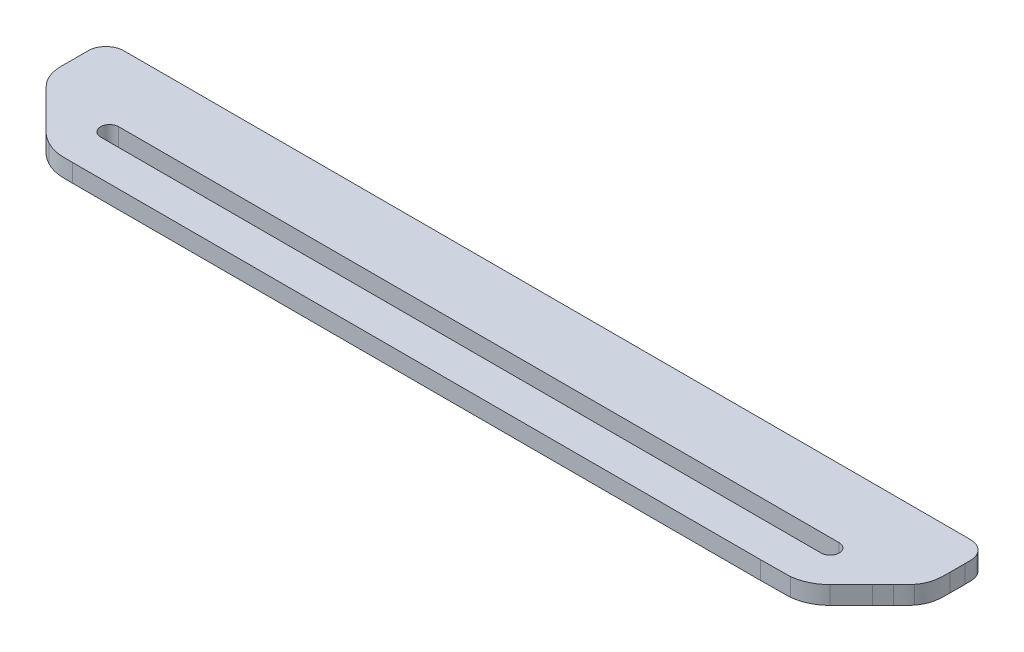
from build123d import *

# Parameters (mm, degrees)
BOSS_EXTRUDE3_DEPTH = 6.35
CUT_EXTRUDE2_DEPTH  = 315.468278946


with BuildPart() as part:
    # Sketch7 → Boss-Extrude3 (new body)
    with BuildSketch(Plane(origin=(0, 0, 0), x_dir=(1, 0, 0), z_dir=(0, 1, 0))):
        with BuildLine():
            add(Edge.make_bspline(
                [(185.1020682, 43.3705), (128.8643346, 43.3705), (72.6196922, 43.3705), (16.3750752, 43.3705)],
                knots=[0, 0, 0, 0, 1, 1, 1, 1], degree=3))
            add(Edge.make_bspline(
                [(16.3750752, 43.3705), (14.6249644, 43.3705), (12.881737, 43.3705), (11.1316262, 43.3705)],
                knots=[0, 0, 0, 0, 1, 1, 1, 1], degree=3))
            add(Edge.make_bspline(
                [(11.1316262, 43.3705), (10.6424476, 43.3705), (6.4187324, 43.3909978), (5.9295284, 43.3360068)],
                knots=[0, 0, 0, 0, 1, 1, 1, 1], degree=3))
            add(Edge.make_bspline(
                [(5.9295284, 43.3360068), (4.0760904, 43.1430938), (2.4017732, 42.1439848), (1.3475716, 40.607488)],
                knots=[0, 0, 0, 0, 1, 1, 1, 1], degree=3))
            add(Edge.make_bspline(
                [(1.3475716, 40.607488), (0.1348994, 38.8367016), (0.238252, 37.5137934), (0.238252, 35.550094)],
                knots=[0, 0, 0, 0, 1, 1, 1, 1], degree=3))
            add(Edge.make_bspline(
                [(0.238252, 35.550094), (0.238252, 33.7999578), (0.238252, 32.049847), (0.238252, 30.2997616)],
                knots=[0, 0, 0, 0, 1, 1, 1, 1], degree=3))
            add(Edge.make_bspline(
                [(0.238252, 30.2997616), (0.238252, 28.5565342), (0.1279906, 26.827099), (0.4656328, 25.0769882)],
                knots=[0, 0, 0, 0, 1, 1, 1, 1], degree=3))
            add(Edge.make_bspline(
                [(0.4656328, 25.0769882), (1.2786868, 20.8808574), (3.3112964, 19.1514222), (6.0880498, 16.3746942)],
                knots=[0, 0, 0, 0, 1, 1, 1, 1], degree=3))
            add(Edge.make_bspline(
                [(6.0880498, 16.3746942), (8.5616288, 13.9010898), (11.0352078, 11.4343942), (13.5087868, 8.9608406)],
                knots=[0, 0, 0, 0, 1, 1, 1, 1], degree=3))
            add(Edge.make_bspline(
                [(13.5087868, 8.9608406), (14.7421092, 7.7206094), (15.975457, 6.4872616), (17.2156882, 5.2470304)],
                knots=[0, 0, 0, 0, 1, 1, 1, 1], degree=3))
            add(Edge.make_bspline(
                [(17.2156882, 5.2470304), (18.4697116, 3.993007), (19.7926198, 2.9112464), (21.3773766, 2.0775422)],
                knots=[0, 0, 0, 0, 1, 1, 1, 1], degree=3))
            add(Edge.make_bspline(
                [(21.3773766, 2.0775422), (25.104979, 0.1000506), (27.6474428, 0.2240788), (31.6368684, 0.2240788)],
                knots=[0, 0, 0, 0, 1, 1, 1, 1], degree=3))
            add(Edge.make_bspline(
                [(31.6368684, 0.2240788), (35.1302066, 0.2240788), (38.6304028, 0.2240788), (42.123741, 0.2240788)],
                knots=[0, 0, 0, 0, 1, 1, 1, 1], degree=3))
            add(Edge.make_bspline(
                [(42.123741, 0.2240788), (70.2632834, 0.2240788), (98.3959424, 0.2240788), (126.5354848, 0.2240788)],
                knots=[0, 0, 0, 0, 1, 1, 1, 1], degree=3))
            add(Edge.make_bspline(
                [(126.5354848, 0.2240788), (154.6543516, 0.2240788), (182.7732184, 0.2240788), (210.8989686, 0.2240788)],
                knots=[0, 0, 0, 0, 1, 1, 1, 1], degree=3))
            add(Edge.make_bspline(
                [(210.8989686, 0.2240788), (224.9480642, 0.2240788), (238.9971598, 0.2240788), (253.0531642, 0.2240788)],
                knots=[0, 0, 0, 0, 1, 1, 1, 1], degree=3))
            add(Edge.make_bspline(
                [(253.0531642, 0.2240788), (260.0742576, 0.2240788), (267.1022598, 0.2240788), (274.1233532, 0.2240788)],
                knots=[0, 0, 0, 0, 1, 1, 1, 1], degree=3))
            add(Edge.make_bspline(
                [(274.1233532, 0.2240788), (275.3498176, 0.2240788), (283.4113204, 0.1895856), (284.644719, 0.3343402)],
                knots=[0, 0, 0, 0, 1, 1, 1, 1], degree=3))
            add(Edge.make_bspline(
                [(284.644719, 0.3343402), (288.2000332, 0.7477252), (291.5072656, 2.3462488), (294.0360134, 4.8749458)],
                knots=[0, 0, 0, 0, 1, 1, 1, 1], degree=3))
            add(Edge.make_bspline(
                [(294.0360134, 4.8749458), (296.5183808, 7.3485248), (298.9919344, 9.8221038), (301.4655134, 12.3025662)],
                knots=[0, 0, 0, 0, 1, 1, 1, 1], degree=3))
            add(Edge.make_bspline(
                [(301.4655134, 12.3025662), (302.7057192, 13.535914), (303.939067, 14.7761706), (305.1793236, 16.009493)],
                knots=[0, 0, 0, 0, 1, 1, 1, 1], degree=3))
            add(Edge.make_bspline(
                [(305.1793236, 16.009493), (306.4126714, 17.2497496), (307.7286708, 18.3866028), (308.7966646, 19.7922134)],
                knots=[0, 0, 0, 0, 1, 1, 1, 1], degree=3))
            add(Edge.make_bspline(
                [(308.7966646, 19.7922134), (311.3598294, 23.1684068), (311.387363, 25.8831334), (311.387363, 29.8036742)],
                knots=[0, 0, 0, 0, 1, 1, 1, 1], degree=3))
            add(Edge.make_bspline(
                [(311.387363, 29.8036742), (311.387363, 31.5537596), (311.3923668, 33.3038704), (311.3923668, 35.0539812)],
                knots=[0, 0, 0, 0, 1, 1, 1, 1], degree=3))
            add(Edge.make_bspline(
                [(311.3923668, 35.0539812), (311.3923668, 36.8247676), (311.5163696, 38.4784346), (310.5586626, 40.1665186)],
                knots=[0, 0, 0, 0, 1, 1, 1, 1], degree=3))
            add(Edge.make_bspline(
                [(310.5586626, 40.1665186), (309.6284638, 41.7994846), (308.0230822, 42.9363632), (306.1696188, 43.2740054)],
                knots=[0, 0, 0, 0, 1, 1, 1, 1], degree=3))
            add(Edge.make_bspline(
                [(306.1696188, 43.2740054), (305.3910326, 43.4117496), (301.759874, 43.3705), (300.9812624, 43.3705)],
                knots=[0, 0, 0, 0, 1, 1, 1, 1], degree=3))
            add(Edge.make_bspline(
                [(300.9812624, 43.3705), (297.4810662, 43.3705), (293.98087, 43.3705), (290.4806738, 43.3705)],
                knots=[0, 0, 0, 0, 1, 1, 1, 1], degree=3))
            add(Edge.make_bspline(
                [(290.4806738, 43.3705), (283.4802306, 43.3705), (276.4797874, 43.3705), (269.4793442, 43.3705)],
                knots=[0, 0, 0, 0, 1, 1, 1, 1], degree=3))
            add(Edge.make_bspline(
                [(269.4793442, 43.3705), (241.353594, 43.3705), (213.2278184, 43.3705), (185.1020682, 43.3705)],
                knots=[0, 0, 0, 0, 1, 1, 1, 1], degree=3))
        make_face()
    extrude(amount=BOSS_EXTRUDE3_DEPTH)

    # Sketch8 → Cut-Extrude2 (cut, through all)
    with BuildSketch(Plane(origin=(0, 0, 0), x_dir=(1, 0, 0), z_dir=(0, 1, 0))):
        with BuildLine():
            Line((28.81376, 19.2754504), (282.812968063, 19.2754504))
            ThreePointArc((282.812968063, 19.2754504), (285.989365063, 16.0990534), (282.812968063, 12.9226564))
            Line((282.812968063, 12.9226564), (28.81376, 12.9226564))
            ThreePointArc((28.81376, 12.9226564), (25.637363, 16.0990534), (28.81376, 19.2754504))
        make_face()
    extrude(amount=CUT_EXTRUDE2_DEPTH, mode=Mode.SUBTRACT)


solid = part.part
